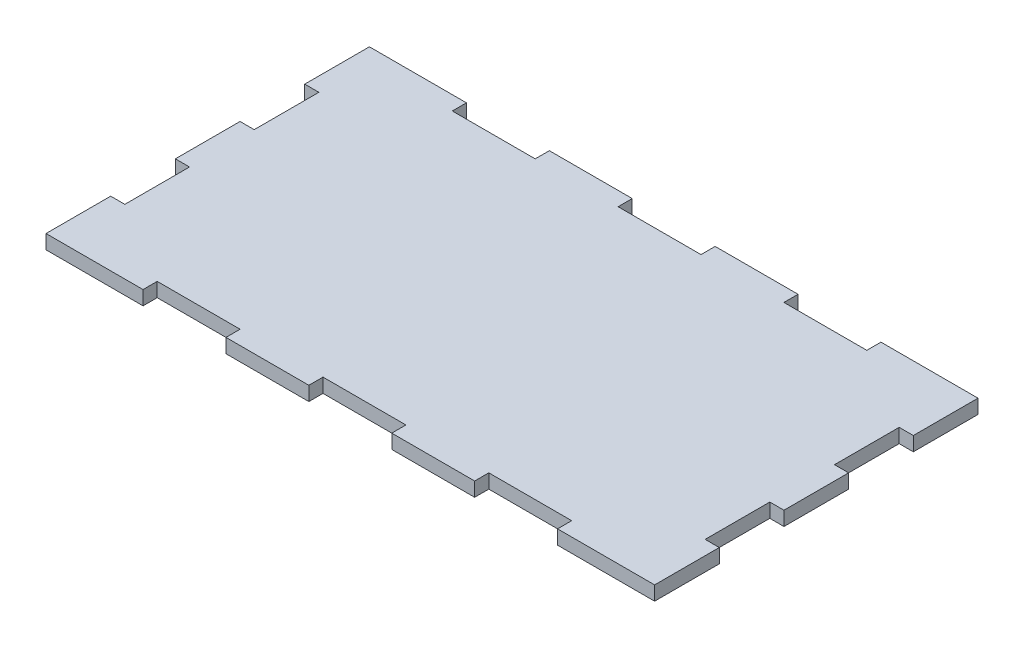
from build123d import *

# Parameters (mm, degrees)
BOSS_EXTRUDE1_DEPTH = 10


with BuildPart() as part:
    # Sketch1 → Boss-Extrude1 (new body)
    with BuildSketch(Plane(origin=(0, 0, 0), x_dir=(1, 0, 0), z_dir=(0, 1, 0))):
        Polygon((-215.1, 114.3), (-146.5, 114.3), (-146.5, 104.3), (-87.9, 104.3), (-87.9, 114.3), (-29.3, 114.3), (-29.3, 104.3), (29.3, 104.3), (29.3, 114.3), (87.9, 114.3), (87.9, 104.3), (146.5, 104.3), (146.5, 114.3), (215.1, 114.3), (215.1, 68.58), (205.1, 68.58), (205.1, 22.86), (215.1, 22.86), (215.1, -22.86), (205.1, -22.86), (205.1, -68.58), (215.1, -68.58), (215.1, -114.3), (205.1, -114.3), (146.5, -114.3), (146.5, -104.3), (87.9, -104.3), (87.9, -114.3), (29.3, -114.3), (29.3, -104.3), (-29.3, -104.3), (-29.3, -114.3), (-87.9, -114.3), (-87.9, -104.3), (-146.5, -104.3), (-146.5, -114.3), (-205.1, -114.3), (-215.1, -114.3), (-215.1, -68.58), (-205.1, -68.58), (-205.1, -22.86), (-215.1, -22.86), (-215.1, 22.86), (-205.1, 22.86), (-205.1, 68.58), (-215.1, 68.58), align=None)
    extrude(amount=BOSS_EXTRUDE1_DEPTH)


solid = part.part
